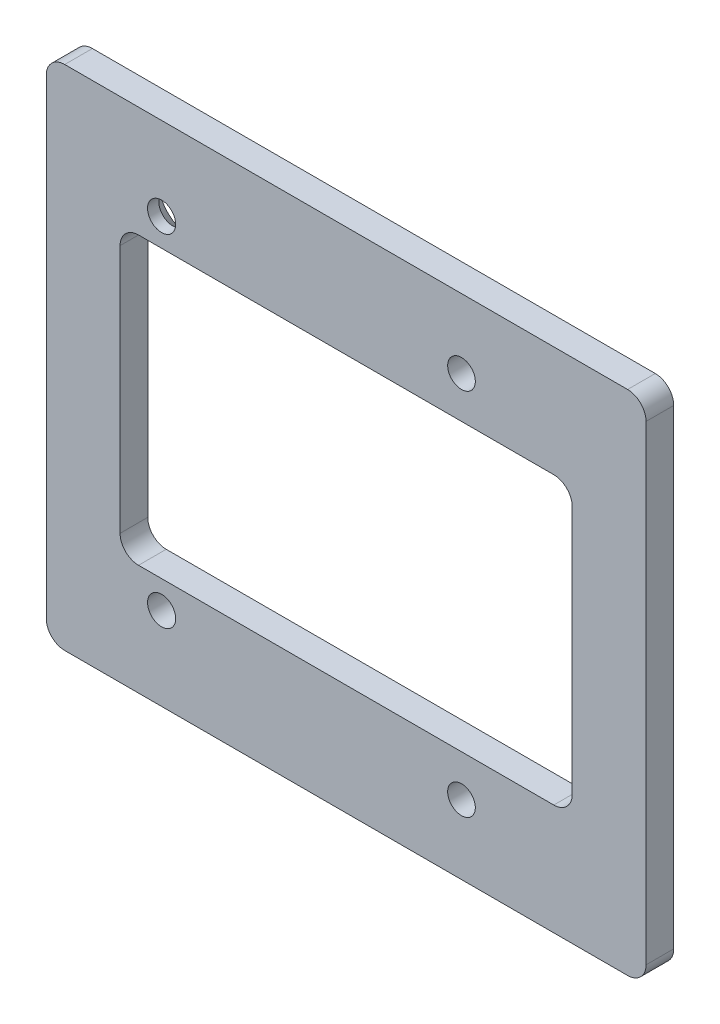
from build123d import *

# Parameters (mm, degrees)
SKETCH_1_W                   = 65
SKETCH_1_H                   = 55
EXTRUDE_1_DEPTH              = 3
FILLET_1_R                   = 2
SKETCH_2_R                   = 1.525
CUT_EXTRUDE_1_DEPTH          = 6
HOLE_WIZARD_M3_1_D           = 3
HOLE_WIZARD_M3_1_DEPTH       = 7.25
HOLE_WIZARD_M3_1_CSINK_D     = 6.6
HOLE_WIZARD_M3_1_CSINK_ANGLE = 90
HOLE_WIZARD_M3_1_TIP         = 0.901290929
SKETCH_9_R                   = 1.5
CUT_EXTRUDE_3_DEPTH          = 10
SKETCH_13_W                  = 49
SKETCH_13_H                  = 31
CUT_EXTRUDE_8_DEPTH          = 10
FILLET_5_R                   = 2


with BuildPart() as part:
    # 草图1 → 凸台-拉伸1 (new body)
    with BuildSketch(Plane.XY):
        Rectangle(SKETCH_1_W, SKETCH_1_H)
    extrude(amount=EXTRUDE_1_DEPTH)

    # 圆角1
    fillet_1_edges = [part.edges().sort_by_distance(p)[0] for p in [
        (32.5, -27.5, 1.5),
        (-32.5, -27.5, 1.5),
        (-32.5, 27.5, 1.5),
        (32.5, 27.5, 1.5),
    ]]
    fillet(fillet_1_edges, radius=FILLET_1_R)

    # 草图2 → 切除-拉伸1 (cut)
    with BuildSketch(Plane(origin=(0, 0, 0), x_dir=(-1, 0, 0), z_dir=(0, 0, -1))):
        with Locations((20, -18.5)):
            Circle(SKETCH_2_R)
        with Locations((20, 18.5)):
            Circle(SKETCH_2_R)
    extrude(amount=-CUT_EXTRUDE_1_DEPTH, mode=Mode.SUBTRACT)

    # M3 十字槽沉头木螺钉的锥形沉头孔1
    with Locations(Plane(origin=(0, 0, 0), x_dir=(-1, 0, 0), z_dir=(0, 0, -1))):
        with Locations((20, 18.5)):
            CounterSinkHole(HOLE_WIZARD_M3_1_D / 2, HOLE_WIZARD_M3_1_CSINK_D / 2, depth=HOLE_WIZARD_M3_1_DEPTH, counter_sink_angle=HOLE_WIZARD_M3_1_CSINK_ANGLE)
            with Locations((0, 0, -(HOLE_WIZARD_M3_1_DEPTH + HOLE_WIZARD_M3_1_TIP / 2))):  # 118° drill point
                Cone(0, HOLE_WIZARD_M3_1_D / 2, HOLE_WIZARD_M3_1_TIP, mode=Mode.SUBTRACT)

    # 草图9 → 切除-拉伸3 (cut)
    with BuildSketch(Plane(origin=(0, 0, 0), x_dir=(-1, 0, 0), z_dir=(0, 0, -1))):
        with Locations((-12.5, 20)):
            Circle(SKETCH_9_R)
        with Locations((-12.5, -20)):
            Circle(SKETCH_9_R)
    extrude(amount=-CUT_EXTRUDE_3_DEPTH, mode=Mode.SUBTRACT)

    # 草图13 → 切除-拉伸8 (cut)
    with BuildSketch(Plane(origin=(0, 0, 0), x_dir=(-1, 0, 0), z_dir=(0, 0, -1))):
        Rectangle(SKETCH_13_W, SKETCH_13_H)
    extrude(amount=-CUT_EXTRUDE_8_DEPTH, mode=Mode.SUBTRACT)

    # 圆角5
    fillet_5_edges = [part.edges().sort_by_distance(p)[0] for p in [
        (-24.5, 15.5, 1.5),
        (-24.5, -15.5, 1.5),
        (24.5, -15.5, 1.5),
        (24.5, 15.5, 1.5),
    ]]
    fillet(fillet_5_edges, radius=FILLET_5_R)


solid = part.part
